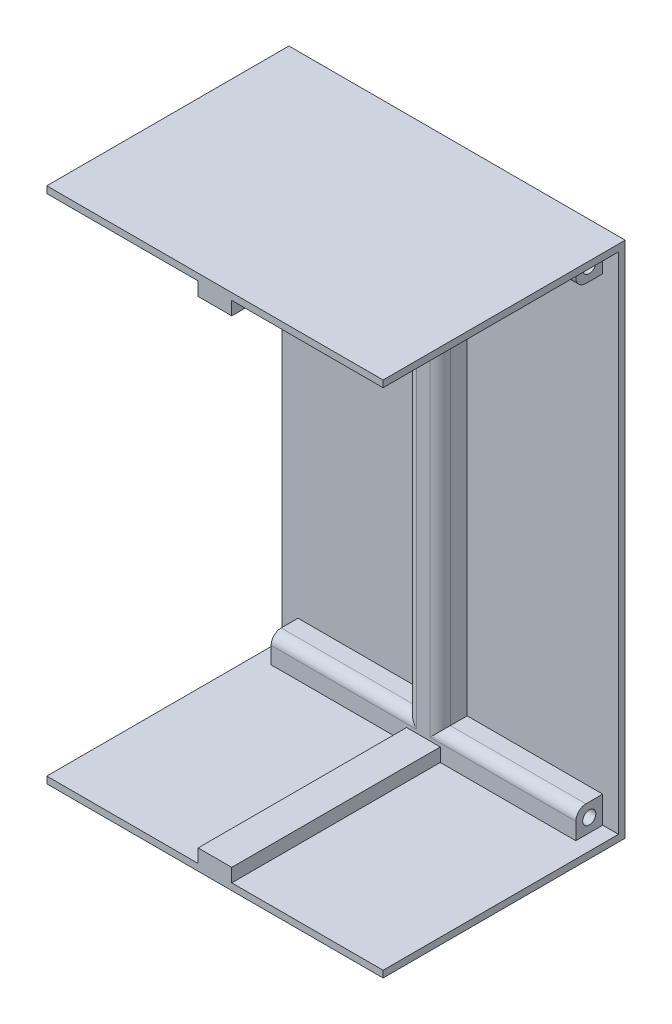
from build123d import *

# Parameters (mm, degrees)
SKETCH1_W           = 154
SKETCH1_H           = 100
BOSS_EXTRUDE1_DEPTH = 2
SKETCH2_W           = 100
SKETCH2_H           = 2
BOSS_EXTRUDE2_DEPTH = 70
SKETCH3_W           = 90.6
SKETCH3_H           = 8
BOSS_EXTRUDE3_DEPTH = 8
SKETCH4_W           = 10
SKETCH4_H           = 134
BOSS_EXTRUDE4_DEPTH = 8
SKETCH5_W           = 10
SKETCH5_H           = 4
BOSS_EXTRUDE5_DEPTH = 62
SKETCH6_R           = 1.95
CUT_EXTRUDE1_DEPTH  = 195.889943301
SKETCH7_R           = 1.95
CUT_EXTRUDE2_DEPTH  = 195.889943301
FILLET1_R           = 3


with BuildPart() as part:
    # Sketch1 → Boss-Extrude1 (new body)
    with BuildSketch(Plane(origin=(0, 0, 0), x_dir=(0, 1, 0), z_dir=(0, 0, 1))):
        with Locations((77, 50)):
            Rectangle(SKETCH1_W, SKETCH1_H)
    extrude(amount=BOSS_EXTRUDE1_DEPTH)

    # Sketch2 → Boss-Extrude2 (add)
    with BuildSketch(Plane.XY.offset(2)):
        with Locations((-50, 153)):
            Rectangle(SKETCH2_W, SKETCH2_H)
        with Locations((-50, 1)):
            Rectangle(SKETCH2_W, SKETCH2_H)
    extrude(amount=BOSS_EXTRUDE2_DEPTH)

    # Sketch3 → Boss-Extrude3 (add)
    with BuildSketch(Plane.XY.offset(2)):
        with Locations((-50, 148)):
            Rectangle(SKETCH3_W, SKETCH3_H)
        with Locations((-50, 6)):
            Rectangle(SKETCH3_W, SKETCH3_H)
    extrude(amount=BOSS_EXTRUDE3_DEPTH)

    # Sketch4 → Boss-Extrude4 (add)
    with BuildSketch(Plane.XY.offset(2)):
        with Locations((-50, 77)):
            Rectangle(SKETCH4_W, SKETCH4_H)
    extrude(amount=BOSS_EXTRUDE4_DEPTH)

    # Sketch5 → Boss-Extrude5 (add)
    with BuildSketch(Plane.XY.offset(10)):
        with Locations((-50, 150)):
            Rectangle(SKETCH5_W, SKETCH5_H)
        with Locations((-50, 4)):
            Rectangle(SKETCH5_W, SKETCH5_H)
    extrude(amount=BOSS_EXTRUDE5_DEPTH)

    # Sketch6 → Cut-Extrude1 (cut, through all)
    with BuildSketch(Plane(origin=(-95.3, 0, 0), x_dir=(0, -1, 0), z_dir=(-1, 0, 0))):
        with Locations((-6, 6)):
            Circle(SKETCH6_R)
    extrude(amount=-CUT_EXTRUDE1_DEPTH, mode=Mode.SUBTRACT)

    # Sketch7 → Cut-Extrude2 (cut, through all)
    with BuildSketch(Plane(origin=(-95.3, 0, 0), x_dir=(0, -1, 0), z_dir=(-1, 0, 0))):
        with Locations(Location((-148, 6, 0), (0, 0, 90))):
            Circle(SKETCH7_R)
    extrude(amount=-CUT_EXTRUDE2_DEPTH, mode=Mode.SUBTRACT)

    # Fillet1
    fillet1_edges = [part.edges().sort_by_distance(p)[0] for p in [
        (-75.15, 144, 10),
        (-24.85, 10, 10),
        (-75.15, 10, 10),
        (-24.85, 144, 10),
        (-55, 77, 10),
        (-45, 77, 10),
    ]]
    fillet(fillet1_edges, radius=FILLET1_R)


solid = part.part
